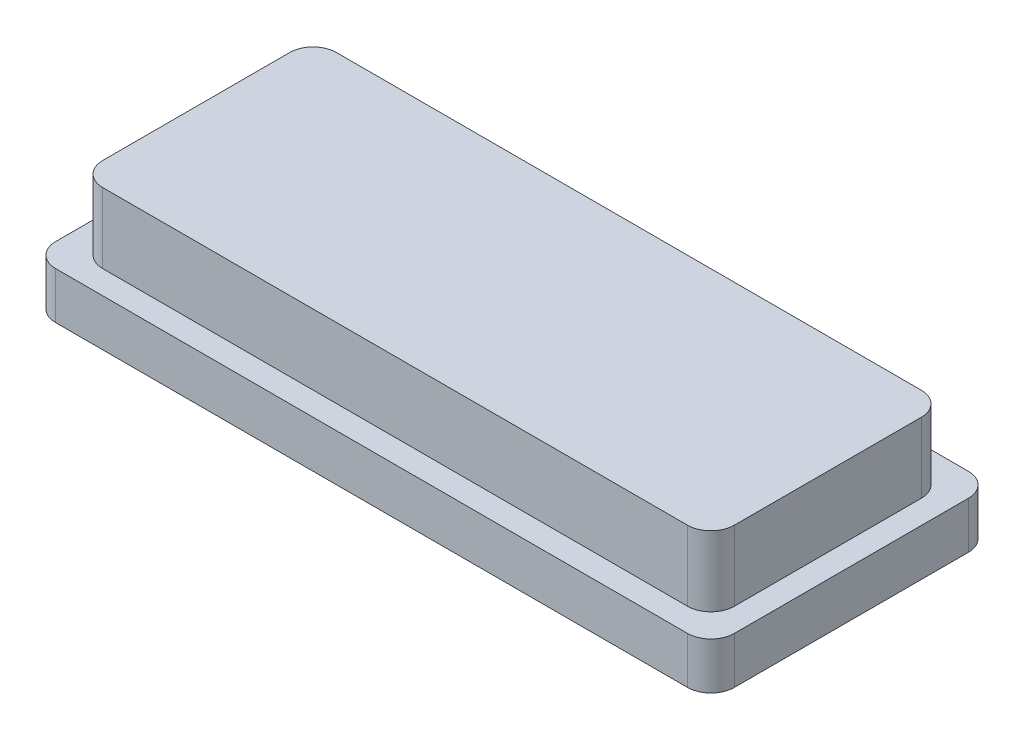
from build123d import *

# Parameters (mm, degrees)
BOSS_EXTRUDE1_DEPTH = 2
BOSS_EXTRUDE2_DEPTH = 3


with BuildPart() as part:
    # Sketch1 → Boss-Extrude1 (new body)
    with BuildSketch(Plane(origin=(0, 0, 0), x_dir=(1, 0, 0), z_dir=(0, 1, 0))):
        with BuildLine():
            Line((-13.5, 6), (13.5, 6))
            ThreePointArc((13.5, 6), (14.207106781, 5.707106781), (14.5, 5))
            Line((14.5, 5), (14.5, -5))
            ThreePointArc((14.5, -5), (14.207106781, -5.707106781), (13.5, -6))
            Line((13.5, -6), (-13.5, -6))
            ThreePointArc((-13.5, -6), (-14.207106781, -5.707106781), (-14.5, -5))
            Line((-14.5, -5), (-14.5, 5))
            ThreePointArc((-14.5, 5), (-14.207106781, 5.707106781), (-13.5, 6))
        make_face()
    extrude(amount=BOSS_EXTRUDE1_DEPTH)

    # Sketch2 → Boss-Extrude2 (add)
    with BuildSketch(Plane(origin=(0, 2, 0), x_dir=(1, 0, 0), z_dir=(0, 1, 0))):
        with BuildLine():
            Line((-12.495, 4.995), (12.495, 4.995))
            ThreePointArc((12.495, 4.995), (13.202106781, 4.702106781), (13.495, 3.995))
            Line((13.495, 3.995), (13.495, -3.995))
            ThreePointArc((13.495, -3.995), (13.202106781, -4.702106781), (12.495, -4.995))
            Line((12.495, -4.995), (-12.495, -4.995))
            ThreePointArc((-12.495, -4.995), (-13.202106781, -4.702106781), (-13.495, -3.995))
            Line((-13.495, -3.995), (-13.495, 3.995))
            ThreePointArc((-13.495, 3.995), (-13.202106781, 4.702106781), (-12.495, 4.995))
        make_face()
    extrude(amount=BOSS_EXTRUDE2_DEPTH)


solid = part.part
